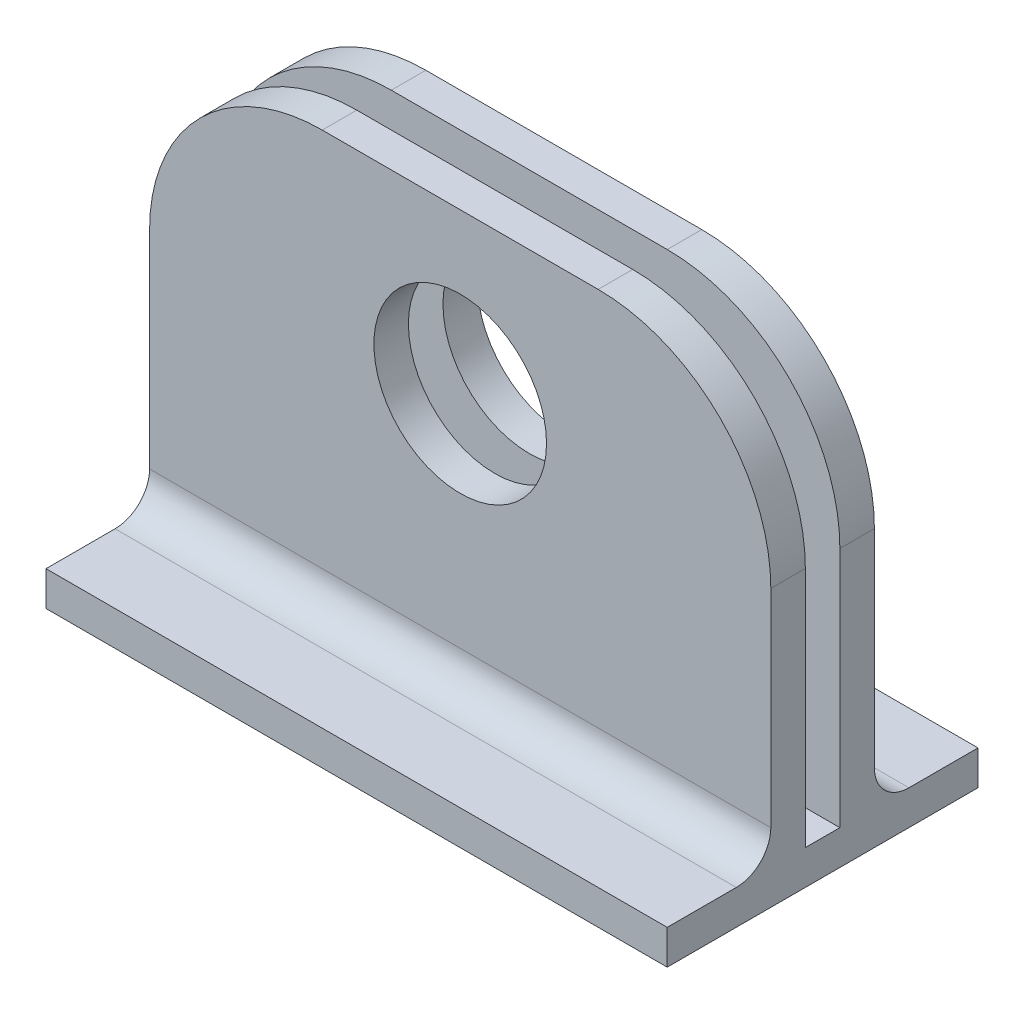
from build123d import *

# Parameters (mm, degrees)
SKETCH1_W                = 35.980750028
SKETCH1_H                = 26
BOSS_EXTRUDE1_DEPTH      = 2
LPATTERN1_COUNT          = 2
LPATTERN1_PITCH          = 4
BOSS_EXTRUDE2_DEPTH      = 6
BOSS_EXTRUDE2_DEPTH_BACK = 12
SKETCH2_W                = 35.980750028
SKETCH2_H                = 2
FILLET1_R                = 2
FILLET2_R                = 10
SKETCH4_R                = 5
CUT_EXTRUDE1_DEPTH       = 6


with BuildPart() as part:
    # Sketch1 → Boss-Extrude1 (new body)
    with BuildSketch(Plane.XY):
        with Locations((17.990375014, 13)):
            Rectangle(SKETCH1_W, SKETCH1_H)
    extrude(amount=BOSS_EXTRUDE1_DEPTH)


with BuildPart() as lpattern1_1:
    # LPattern1: pattern copy
    add(part.part.moved(Location(Vector(0, 0, 1) * (1 * LPATTERN1_PITCH))))


with BuildPart() as part_1:
    add(part.part)

    add(lpattern1_1.part)  # Boss-Extrude2 merges LPattern1_1
    # Sketch2 → Boss-Extrude2 (add, two sides: drawn at the far end of the back side and taken through both)
    with BuildSketch(Plane(origin=(0, 0, 0), x_dir=(-1, 0, 0), z_dir=(0, 0, -1)).offset(-BOSS_EXTRUDE2_DEPTH_BACK)):
        with Locations((-17.990375014, 1)):
            Rectangle(SKETCH2_W, SKETCH2_H)
    extrude(amount=BOSS_EXTRUDE2_DEPTH + BOSS_EXTRUDE2_DEPTH_BACK)

    # Fillet1
    fillet1_edges = [part_1.edges().sort_by_distance(p)[0] for p in [
        (17.990375014, 2, 0),
        (17.990375014, 2, 6),
    ]]
    fillet(fillet1_edges, radius=FILLET1_R)

    # Fillet2
    fillet2_edges = [part_1.edges().sort_by_distance(p)[0] for p in [
        (0, 26, 5),
        (35.980750028, 26, 5),
        (0, 26, 1),
        (35.980750028, 26, 1),
    ]]
    fillet(fillet2_edges, radius=FILLET2_R)

    # Sketch4 → Cut-Extrude1 (cut)
    with BuildSketch(Plane.XY.offset(6)):
        with Locations((17.990375014, 16.77)):
            Circle(SKETCH4_R)
    extrude(amount=-CUT_EXTRUDE1_DEPTH, mode=Mode.SUBTRACT)


solid = part_1.part
